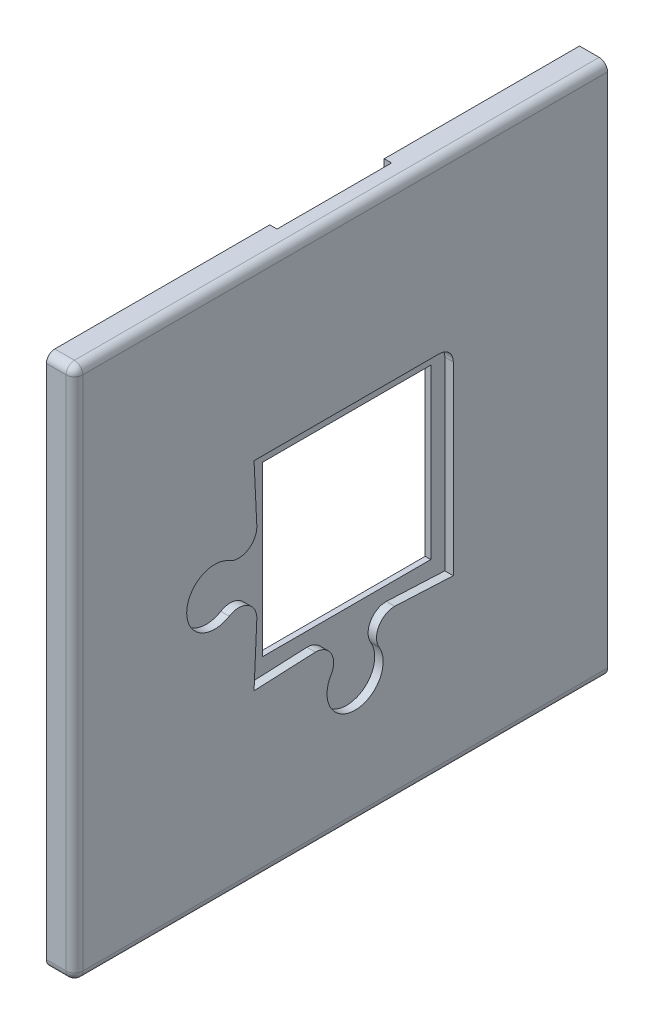
from build123d import *

# Parameters (mm, degrees)
SKETCH1_W           = 190
SKETCH1_H           = 190
BOSS_EXTRUDE1_DEPTH = 10
CUT_EXTRUDE1_DEPTH  = 5
SKETCH3_W           = 60
SKETCH3_H           = 60
CUT_EXTRUDE2_DEPTH  = 139.021737418
CUT_EXTRUDE3_DEPTH  = 3
SKETCH8_W           = 40.8
SKETCH8_H           = 12.294985481
CUT_EXTRUDE4_DEPTH  = 2.6
CUT_EXTRUDE5_DEPTH  = 7
FILLET1_R           = 3
SKETCH10_W          = 3.1
SKETCH10_H          = 5.2
CUT_EXTRUDE6_DEPTH  = 15
FILLET2_R           = 1
SKETCH11_W          = 3.1
SKETCH11_H          = 5.2
CUT_EXTRUDE7_DEPTH  = 15
FILLET3_R           = 1
FILLET4_R           = 4
SKETCH12_W          = 4
SKETCH12_H          = 5.2
CUT_EXTRUDE8_DEPTH  = 2
SKETCH13_W          = 3
SKETCH13_H          = 5.2
CUT_EXTRUDE9_DEPTH  = 6
SKETCH14_W          = 3
SKETCH14_H          = 10
BOSS_EXTRUDE2_DEPTH = 7
SKETCH16_W          = 3.2
SKETCH16_H          = 5
CUT_EXTRUDE10_DEPTH = 6
FILLET5_R           = 1
SKETCH17_W          = 131.159114754
SKETCH17_H          = 131.95401848
CUT_EXTRUDE11_DEPTH = 2.1
CUT_EXTRUDE12_DEPTH = 2


with BuildPart() as part:
    # Sketch1 → Boss-Extrude1 (new body)
    with BuildSketch(Plane(origin=(0, 0, 0), x_dir=(0, 0, -1), z_dir=(1, 0, 0))):
        with Locations((-5, 0)):
            Rectangle(SKETCH1_W, SKETCH1_H)
    extrude(amount=BOSS_EXTRUDE1_DEPTH)

    # Sketch2 → Cut-Extrude1 (cut)
    with BuildSketch(Plane.ZY):
        Polygon((36.5, -36.5), (36.5, 36.5), (25.709845909, 36.5), (5.209845909, 45.5), (-5.209845909, 45.5), (-25.709845909, 36.5), (-36.5, 36.5), (-36.5, -36.5), align=None)
    extrude(amount=-CUT_EXTRUDE1_DEPTH, mode=Mode.SUBTRACT)

    # Sketch3 → Cut-Extrude2 (cut, through all)
    with BuildSketch(Plane.ZY.offset(-5)):
        Rectangle(SKETCH3_W, SKETCH3_H)
    extrude(amount=-CUT_EXTRUDE2_DEPTH, mode=Mode.SUBTRACT)

    # Sketch4 → Cut-Extrude3 (cut)
    with BuildSketch(Plane(origin=(10, 0, 0), x_dir=(0, 0, -1), z_dir=(1, 0, 0))):
        with BuildLine():
            Line((35, 29.999999003), (35, -35.000000997))
            Line((35, -35.000000997), (35, -36.000000997))
            Line((35, -36.000000997), (14.142135624, -35.000000997))
            ThreePointArc((14.142135624, -35.000000997), (8.484611805, -38.299622231), (8.570991287, -44.848485845))
            ThreePointArc((8.570991287, -44.848485845), (0, -60.000000997), (-8.570991287, -44.848485845))
            ThreePointArc((-8.570991287, -44.848485845), (-8.484611805, -38.299622231), (-14.142135624, -35.000000997))
            Line((-14.142135624, -35.000000997), (-36, -36.000000997))
            Line((-36, -36.000000997), (-35.000001658, -14.142137383))
            ThreePointArc((-35.000001658, -14.142137383), (-38.29962223, -8.484613177), (-44.848485854, -8.570991891))
            ThreePointArc((-44.848485854, -8.570991891), (-60, 1.173e-06), (-44.848483843, 8.570990683))
            ThreePointArc((-44.848483843, 8.570990683), (-38.29962024, 8.484610433), (-34.999998342, 14.142133865))
            Line((-34.999998342, 14.142133865), (-36, 34.999999003))
            Line((-36, 34.999999003), (-35, 34.999999003))
            Line((-35, 34.999999003), (30, 34.999999003))
            ThreePointArc((30, 34.999999003), (33.535533906, 33.535532909), (35, 29.999999003))
        make_face()
    extrude(amount=-CUT_EXTRUDE3_DEPTH, mode=Mode.SUBTRACT)

    # Sketch8 → Cut-Extrude4 (cut)
    with BuildSketch(Plane.ZY):
        with Locations((0, 92.547492741)):
            Rectangle(SKETCH8_W, SKETCH8_H)
    extrude(amount=-CUT_EXTRUDE4_DEPTH, mode=Mode.SUBTRACT)

    # Sketch9 → Cut-Extrude5 (cut)
    # profile 1 of 2: a face of its own
    with BuildSketch(Plane.ZY):
        Polygon((-25.4, 90), (-85, 90), (-85, -90), (95, -90), (95, 90), (25.4, 90), (25.4, 81.4), (-25.4, 81.4), align=None)
        Polygon((-41.5, -41.5), (-41.5, 41.5), (-19.296204392, 41.5), (-5.629537726, 47.5), (5.629537726, 47.5), (19.296204392, 41.5), (41.5, 41.5), (41.5, 12.5), (61.5, 12.5), (61.5, -12.5), (41.5, -12.5), (41.5, -41.5), (12.5, -41.5), (12.5, -61.5), (-12.5, -61.5), (-12.5, -41.5), align=None, mode=Mode.SUBTRACT)
    # profile 2 of 2: a face of its own
    with BuildSketch(Plane.ZY):
        Polygon((-5.629537726, 47.5), (5.629537726, 47.5), (5.209845909, 45.5), (-5.209845909, 45.5), align=None)
    extrude(amount=-CUT_EXTRUDE5_DEPTH, mode=Mode.SUBTRACT)

    # Fillet1
    fillet1_edges = [part.edges().sort_by_distance(p)[0] for p in [
        (10, 95, 5),
        (10, 0, 100),
        (5, 95, 100),
        (5, -95, 100),
        (10, -95, 5),
    ]]
    fillet(fillet1_edges, radius=FILLET1_R)

    # Sketch10 → Cut-Extrude6 (cut)
    with BuildSketch(Plane.XZ.offset(61.5)):
        with Locations((4.25, 0)):
            Rectangle(SKETCH10_W, SKETCH10_H)
    extrude(amount=-CUT_EXTRUDE6_DEPTH, mode=Mode.SUBTRACT)

    # Fillet2
    fillet2_edges = [part.edges().sort_by_distance(p)[0] for p in [
        (2.7, -61.5, 0),
        (4.25, -61.5, -2.6),
        (5.8, -61.5, 0),
        (4.25, -61.5, 2.6),
    ]]
    fillet(fillet2_edges, radius=FILLET2_R)

    # Sketch11 → Cut-Extrude7 (cut)
    with BuildSketch(Plane.XY.offset(61.5)):
        with Locations((4.25, 0)):
            Rectangle(SKETCH11_W, SKETCH11_H)
    extrude(amount=-CUT_EXTRUDE7_DEPTH, mode=Mode.SUBTRACT)

    # Fillet3
    fillet3_edges = [part.edges().sort_by_distance(p)[0] for p in [
        (2.7, 0, 61.5),
        (4.25, -2.6, 61.5),
        (5.8, 0, 61.5),
        (4.25, 2.6, 61.5),
    ]]
    fillet(fillet3_edges, radius=FILLET3_R)

    # Fillet4
    fillet4_edges = [part.edges().sort_by_distance(p)[0] for p in [
        (3.5, -61.5, -12.5),
        (3.5, -61.5, 12.5),
        (3.5, -12.5, 61.5),
        (3.5, 12.5, 61.5),
    ]]
    fillet(fillet4_edges, radius=FILLET4_R)

    # Sketch12 → Cut-Extrude8 (cut)
    with BuildSketch(Plane.ZY):
        with Locations((-87, -82.4)):
            Rectangle(SKETCH12_W, SKETCH12_H)
    extrude(amount=-CUT_EXTRUDE8_DEPTH, mode=Mode.SUBTRACT)

    # Sketch13 → Cut-Extrude9 (cut)
    with BuildSketch(Plane.ZY.offset(-2)):
        with Locations((-87.5, -82.4)):
            Rectangle(SKETCH13_W, SKETCH13_H)
    extrude(amount=-CUT_EXTRUDE9_DEPTH, mode=Mode.SUBTRACT)

    # Sketch14 → Boss-Extrude2 (add)
    with BuildSketch(Plane.ZY.offset(-7)):
        with Locations((93.5, -82.4)):
            Rectangle(SKETCH14_W, SKETCH14_H)
    extrude(amount=BOSS_EXTRUDE2_DEPTH)

    # Sketch16 → Cut-Extrude10 (cut)
    with BuildSketch(Plane(origin=(0, 0, 92), x_dir=(-1, 0, 0), z_dir=(0, 0, -1))):
        with Locations((-2.8, -82.4)):
            Rectangle(SKETCH16_W, SKETCH16_H)
    extrude(amount=-CUT_EXTRUDE10_DEPTH, mode=Mode.SUBTRACT)

    # Fillet5
    fillet5_edges = [part.edges().sort_by_distance(p)[0] for p in [
        (4.4, -82.4, 92),
        (2.8, -84.9, 92),
        (2.8, -79.9, 92),
    ]]
    fillet(fillet5_edges, radius=FILLET5_R)

    # Sketch17 → Cut-Extrude11 (cut)
    with BuildSketch(Plane.ZY):
        Rectangle(SKETCH17_W, SKETCH17_H)
    extrude(amount=-CUT_EXTRUDE11_DEPTH, mode=Mode.SUBTRACT)

    # Sketch18 → Cut-Extrude12 (cut)
    with BuildSketch(Plane.ZY):
        Polygon((-23.4, 92), (-87, 92), (-87, -79.8), (-85, -79.8), (-85, 90), (-25.4, 90), (-25.4, 81.4), (25.4, 81.4), (25.4, 90), (95, 90), (95, -77.4), (97, -77.4), (97, 92), (23.4, 92), (23.4, 83.4), (-23.4, 83.4), align=None)
        Polygon((-85, -79.8), (-87, -79.8), (-87, -85), (-85, -85), (-85, -90), (95, -90), (95, -87.4), (92, -87.4), (92, -77.4), (95, -77.4), (95, 90), (25.4, 90), (25.4, 81.4), (-25.4, 81.4), (-25.4, 90), (-85, 90), align=None)
        Polygon((-85, -85), (-87, -85), (-87, -92), (97, -92), (97, -87.4), (95, -87.4), (95, -90), (-85, -90), align=None)
    extrude(amount=-CUT_EXTRUDE12_DEPTH, mode=Mode.SUBTRACT)


solid = part.part
